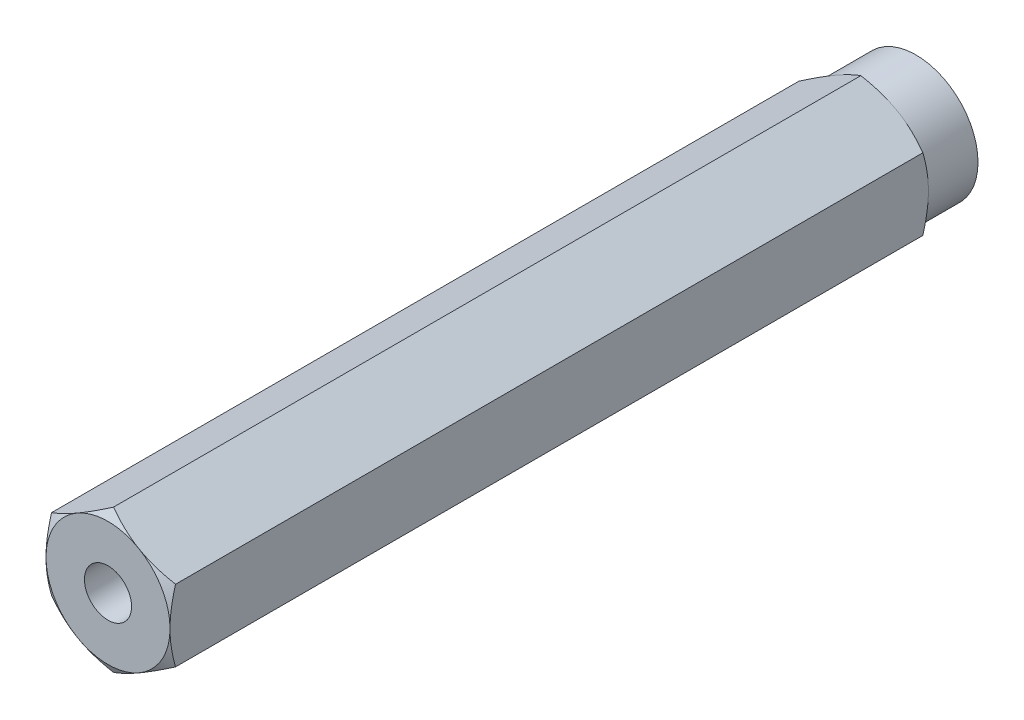
from build123d import *

# Parameters (mm, degrees)
SKETCH1_R               = 2.413
EXTRUDE1_DEPTH          = 77.6605
SKETCH8_OUTSIDE_W       = 305.288
SKETCH8_OUTSIDE_H       = 307.252
SKETCH8_OUTSIDE_R       = 6.35
EXTRUDE4_DEPTH          = 79.26390671
EXTRUDE4_DRAFT          = -60
MIRROR1_COPY_1_SKETCH_W = 305.288
MIRROR1_COPY_1_SKETCH_H = 307.252
MIRROR1_COPY_1_SKETCH_R = 6.35
MIRROR1_COPY_1_DEPTH    = 79.26390671
MIRROR1_COPY_1_DRAFT    = -60
BOSS_EXTRUDE1_START     = -5.08
SKETCH13_R              = 6.35
SKETCH13_R_2            = 2.413
BOSS_EXTRUDE1_DEPTH     = 5.08


with BuildPart() as part:
    # Sketch1 → Extrude1 (new body)
    with BuildSketch(Plane.XY):
        Polygon((0, 7.332348419), (-6.35, 3.666174209), (-6.35, -3.666174209), (0, -7.332348419), (6.35, -3.666174209), (6.35, 3.666174209), align=None)
        Circle(SKETCH1_R, mode=Mode.SUBTRACT)
    extrude(amount=EXTRUDE1_DEPTH)

    # Extrude3 cone 1 section (through the dimple's axis) → Extrude3 (revolve, cut)
    with BuildSketch(Plane.YZ):
        Polygon((0, 0), (2.4638, 0), (0, 2.642102028), align=None)
    revolve(axis=Axis((0, 0, 0), (0, 0, 1)), mode=Mode.SUBTRACT)


with BuildPart() as extrude4_tool:
    # Sketch8 outside → Extrude4 (with draft: the straight prism first)
    with BuildSketch(Plane(origin=(0, 0, 0), x_dir=(-1, 0, 0), z_dir=(0, 0, -1))):
        Rectangle(SKETCH8_OUTSIDE_W, SKETCH8_OUTSIDE_H)
        Circle(SKETCH8_OUTSIDE_R, mode=Mode.SUBTRACT)
    extrude(amount=-EXTRUDE4_DEPTH)
    # Extrude4: the draft: its side faces are tilted about the plane it starts from
    extrude4_sides = [extrude4_tool.faces().sort_by_distance(p)[0] for p in [
        (0, -153.626, 39.631953355),
        (-152.644, 0, 39.631953355),
        (0, 153.626, 39.631953355),
        (152.644, 0, 39.631953355),
        (6.35, 0, 39.631953355),
    ]]
    draft(extrude4_sides, Plane(origin=(0, 0, 0), x_dir=(-1, 0, 0), z_dir=(0, 0, -1)), EXTRUDE4_DRAFT)


with BuildPart() as part_1:
    add(part.part)

    # Extrude4: cut by extrude4_tool
    add(extrude4_tool.part, mode=Mode.SUBTRACT)


with BuildPart() as mirror1_copy_1_tool:
    # Mirror1 copy 1 sketch → Mirror1 copy 1 (with draft: the straight prism first)
    with BuildSketch(Plane(origin=(0, 0, 77.6605), x_dir=(-1, 0, 0), z_dir=(0, 0, 1))):
        Rectangle(MIRROR1_COPY_1_SKETCH_W, MIRROR1_COPY_1_SKETCH_H)
        Circle(MIRROR1_COPY_1_SKETCH_R, mode=Mode.SUBTRACT)
    extrude(amount=-MIRROR1_COPY_1_DEPTH)
    # Mirror1 copy 1: the draft: its side faces are tilted about the plane it starts from
    mirror1_copy_1_sides = [mirror1_copy_1_tool.faces().sort_by_distance(p)[0] for p in [
        (0, -153.626, 38.028546645),
        (-152.644, 0, 38.028546645),
        (0, 153.626, 38.028546645),
        (152.644, 0, 38.028546645),
        (6.35, 0, 38.028546645),
    ]]
    draft(mirror1_copy_1_sides, Plane(origin=(0, 0, 77.6605), x_dir=(-1, 0, 0), z_dir=(0, 0, 1)), MIRROR1_COPY_1_DRAFT)


with BuildPart() as part_2:
    add(part_1.part)

    # Mirror1 copy 1: cut by mirror1_copy_1_tool
    add(mirror1_copy_1_tool.part, mode=Mode.SUBTRACT)

    # Sketch13 → Boss-Extrude1 (add)
    with BuildSketch(Plane.XY.offset(BOSS_EXTRUDE1_START)):
        Circle(SKETCH13_R)
        with Locations(Location((0, 0, 0), (0, 0, 180))):
            Circle(SKETCH13_R_2, mode=Mode.SUBTRACT)
    extrude(amount=BOSS_EXTRUDE1_DEPTH)


solid = part_2.part
